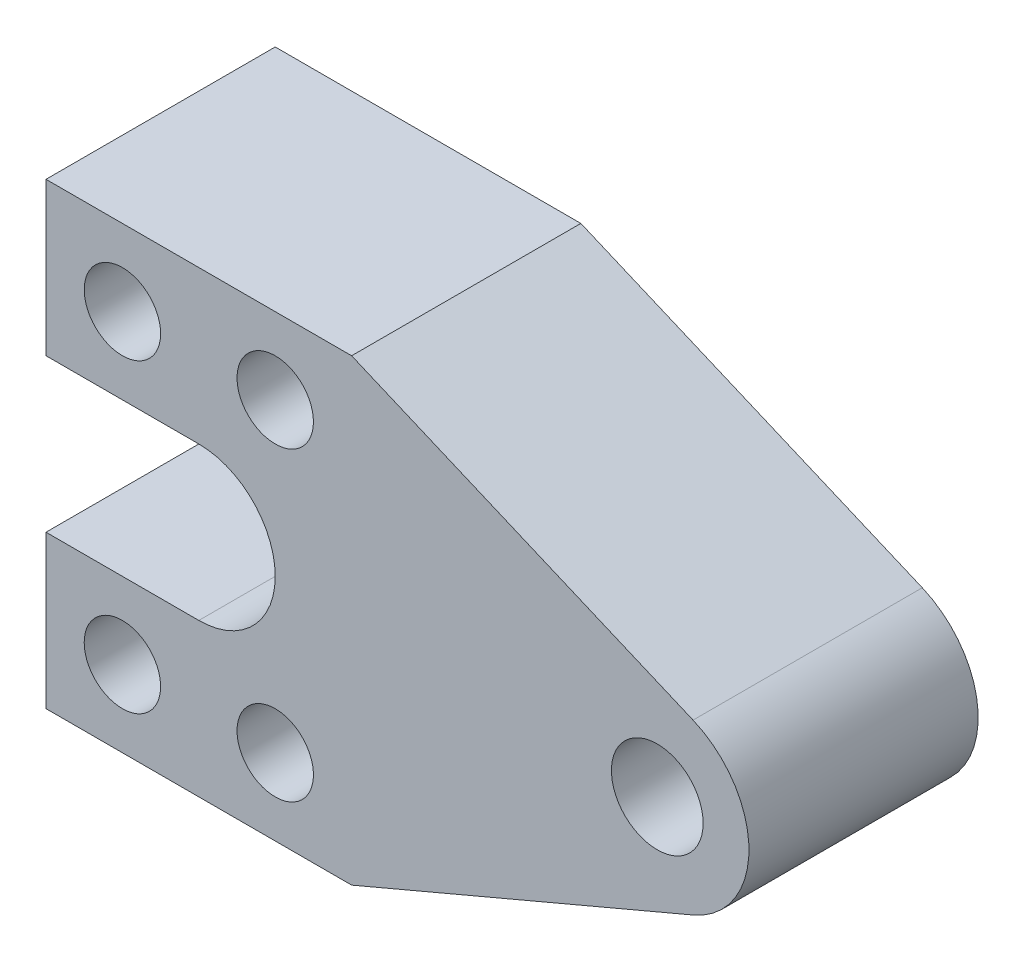
from build123d import *

# Parameters (mm, degrees)
SKETCH1_R           = 5
SKETCH1_R_2         = 6
BOSS_EXTRUDE2_DEPTH = 15


with BuildPart() as part:
    # Sketch1 → Boss-Extrude2 (new, symmetric)
    with BuildSketch(Plane.XY):
        with BuildLine():
            Line((10, 10), (50, 10))
            Line((50, 10), (94.685564793, 28.952580276))
            ThreePointArc((94.685564793, 28.952580276), (102, 40), (94.685564793, 51.047419724))
            Line((94.685564793, 51.047419724), (50, 70))
            Line((50, 70), (10, 70))
            Line((10, 70), (10, 50))
            Line((10, 50), (30, 50))
            ThreePointArc((30, 50), (40, 40), (30, 30))
            Line((30, 30), (10, 30))
            Line((10, 30), (10, 10))
        make_face()
        with Locations((20, 60)):
            Circle(SKETCH1_R, mode=Mode.SUBTRACT)
        with Locations((40, 60)):
            Circle(SKETCH1_R, mode=Mode.SUBTRACT)
        with Locations((90, 40)):
            Circle(SKETCH1_R_2, mode=Mode.SUBTRACT)
        with Locations(Location((40, 20, 0), (0, 0, 180))):
            Circle(SKETCH1_R, mode=Mode.SUBTRACT)
        with Locations(Location((20, 20, 0), (0, 0, 180))):
            Circle(SKETCH1_R, mode=Mode.SUBTRACT)
    extrude(amount=BOSS_EXTRUDE2_DEPTH, both=True)


solid = part.part
